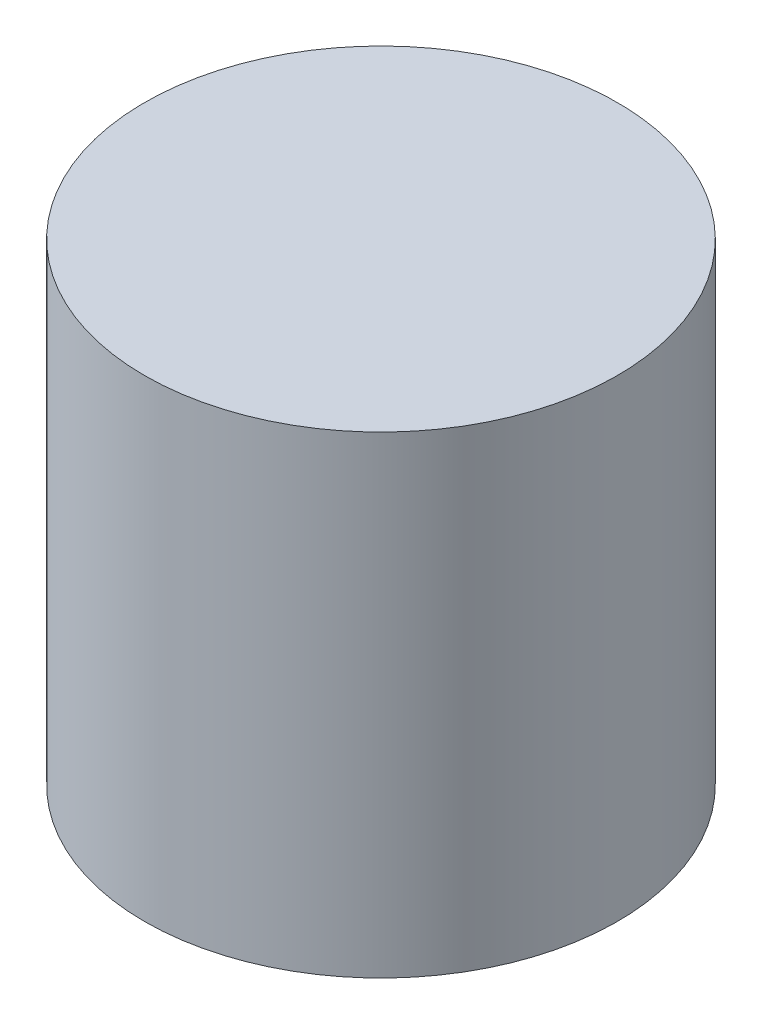
from build123d import *

# Parameters (mm, degrees)
SKETCH1_R           = 1.5
BOSS_EXTRUDE1_DEPTH = 3


with BuildPart() as part:
    # Sketch1 → Boss-Extrude1 (new body)
    with BuildSketch(Plane(origin=(0, 0, 0), x_dir=(1, 0, 0), z_dir=(0, 1, 0))):
        with Locations(Location((0, 0, 0), (0, 0, 270))):
            Circle(SKETCH1_R)
    extrude(amount=BOSS_EXTRUDE1_DEPTH)


solid = part.part
